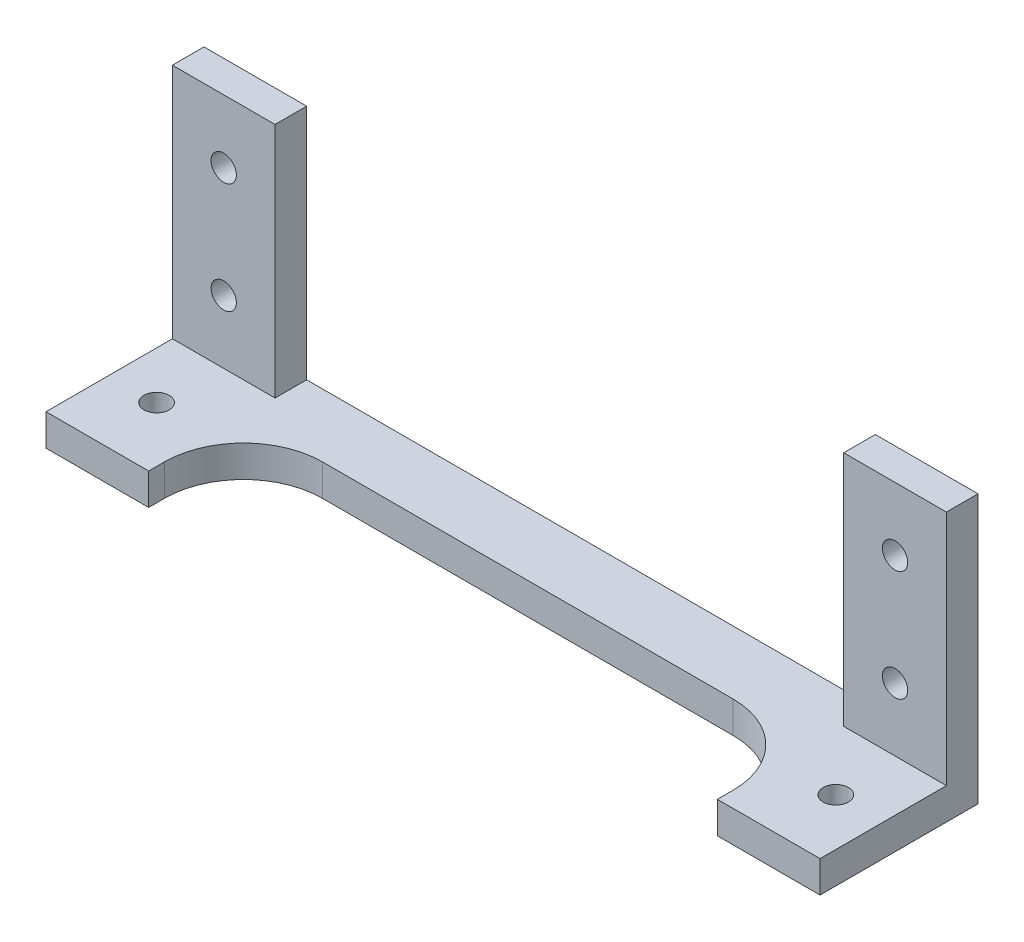
from build123d import *

# Parameters (mm, degrees)
BOSS_EXTRUDE1_DEPTH = 2
SKETCH2_W           = 49
SKETCH2_H           = 2
BOSS_EXTRUDE2_DEPTH = 8
SKETCH3_R           = 0.8
CUT_EXTRUDE1_DEPTH  = 2
SKETCH4_R           = 0.8
CUT_EXTRUDE2_DEPTH  = 2
CUT_EXTRUDE3_DEPTH  = 2


with BuildPart() as part:
    # Sketch1 → Boss-Extrude1 (new body)
    with BuildSketch(Plane.XY):
        Polygon((42.5, 17), (49, 17), (49, 0), (0, 0), (0, 17), (6.5, 17), (6.5, 2), (42.5, 2), align=None)
    extrude(amount=BOSS_EXTRUDE1_DEPTH)

    # Sketch2 → Boss-Extrude2 (add)
    with BuildSketch(Plane.XY.offset(2)):
        with Locations((24.5, 1)):
            Rectangle(SKETCH2_W, SKETCH2_H)
    extrude(amount=BOSS_EXTRUDE2_DEPTH)

    # Sketch3 → Cut-Extrude1 (cut)
    with BuildSketch(Plane.XY.offset(2)):
        with Locations((3.25, 13)):
            Circle(SKETCH3_R)
        with Locations((3.25, 6)):
            Circle(SKETCH3_R)
        with Locations((45.75, 13)):
            Circle(SKETCH3_R)
        with Locations((45.75, 6)):
            Circle(SKETCH3_R)
    extrude(amount=-CUT_EXTRUDE1_DEPTH, mode=Mode.SUBTRACT)

    # Sketch4 → Cut-Extrude2 (cut)
    with BuildSketch(Plane(origin=(0, 2, 0), x_dir=(1, 0, 0), z_dir=(0, 1, 0))):
        with Locations((3, -6)):
            Circle(SKETCH4_R)
        with Locations((46, -6)):
            Circle(SKETCH4_R)
    extrude(amount=-CUT_EXTRUDE2_DEPTH, mode=Mode.SUBTRACT)

    # Sketch5 → Cut-Extrude3 (cut)
    with BuildSketch(Plane(origin=(0, 2, 0), x_dir=(1, 0, 0), z_dir=(0, 1, 0))):
        with BuildLine():
            Line((6.5, -10), (6.5, -9))
            ThreePointArc((6.5, -9), (7.964466094, -5.464466094), (11.5, -4))
            Line((11.5, -4), (37.5, -4))
            ThreePointArc((37.5, -4), (41.035533906, -5.464466094), (42.5, -9))
            Line((42.5, -9), (42.5, -10))
            Line((42.5, -10), (6.5, -10))
        make_face()
    extrude(amount=-CUT_EXTRUDE3_DEPTH, mode=Mode.SUBTRACT)


solid = part.part
